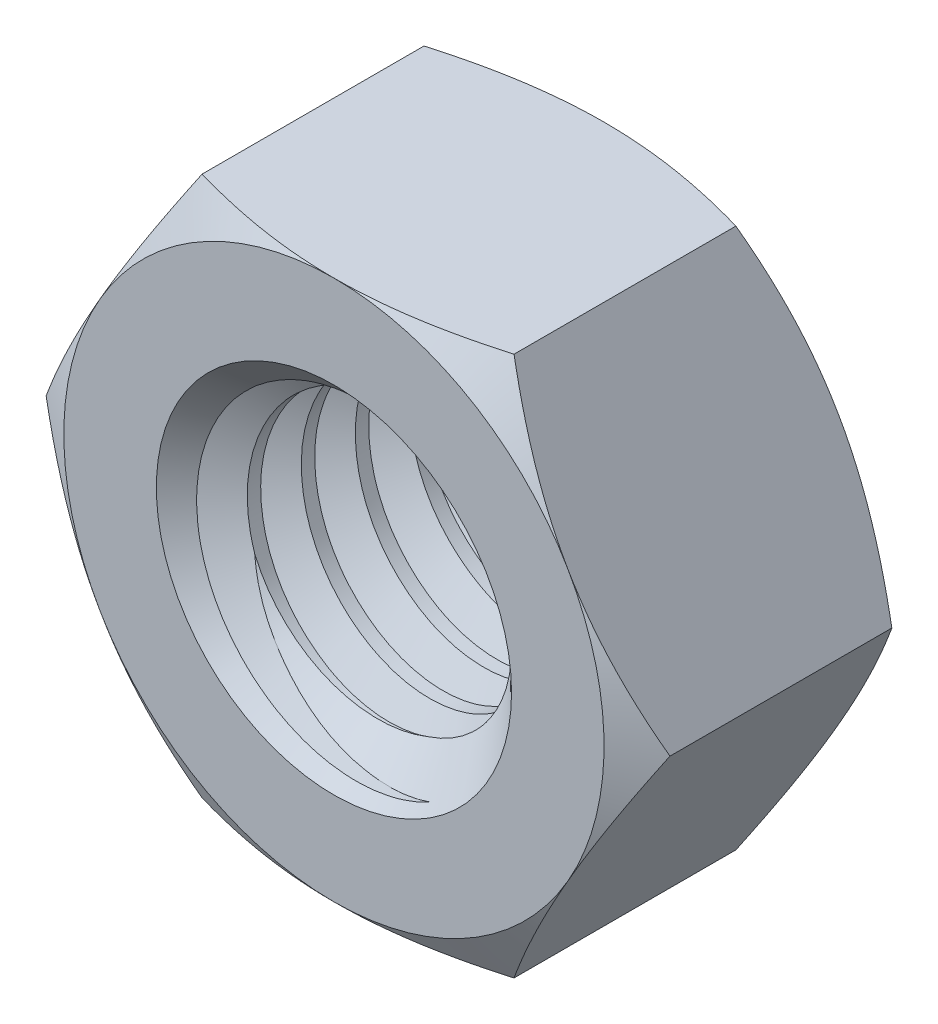
from build123d import *

# Parameters (mm, degrees)
Y_KSEKLIK_EKSTR_ZYON1_DEPTH = 4
IZIM2_OUTSIDE_W             = 27.666
IZIM2_OUTSIDE_H             = 26.428
IZIM2_OUTSIDE_R             = 4
KES_EKSTR_ZYON1_DEPTH       = 4
KES_EKSTR_ZYON1_DRAFT       = -60
IZIM3_OUTSIDE_W             = 27.666
IZIM3_OUTSIDE_H             = 26.428
IZIM3_OUTSIDE_R             = 4
KES_EKSTR_ZYON2_DEPTH       = 4
KES_EKSTR_ZYON2_DRAFT       = -60
IZIM4_R                     = 1.98
KES_EKSTR_ZYON3_DEPTH       = 4
PAH1_SIZE                   = 0.65
KES_S_P_R1_PITCH            = 0.8
KES_S_P_R1_HEIGHT           = 5
KES_S_P_R1_RADIUS           = 1.98


with BuildPart() as part:
    # Çizim1 → Yükseklik-Ekstrüzyon1 (new body)
    with BuildSketch(Plane.XY):
        Polygon((4.618802154, 0), (2.309401077, 4), (-2.309401077, 4), (-4.618802154, 0), (-2.309401077, -4), (2.309401077, -4), align=None)
    extrude(amount=Y_KSEKLIK_EKSTR_ZYON1_DEPTH)


with BuildPart() as kes_ekstr_zyon1_tool:
    # Çizim2 outside → Kes-Ekstrüzyon1 (with draft: the straight prism first)
    with BuildSketch(Plane.XY.offset(4)):
        Rectangle(IZIM2_OUTSIDE_W, IZIM2_OUTSIDE_H)
        Circle(IZIM2_OUTSIDE_R, mode=Mode.SUBTRACT)
    extrude(amount=-KES_EKSTR_ZYON1_DEPTH)
    # Kes-Ekstrüzyon1: the draft: its side faces are tilted about the plane it starts from
    kes_ekstr_zyon1_sides = [kes_ekstr_zyon1_tool.faces().sort_by_distance(p)[0] for p in [
        (0, -13.214, 2),
        (13.833, 0, 2),
        (0, 13.214, 2),
        (-13.833, 0, 2),
        (-4, 0, 2),
    ]]
    draft(kes_ekstr_zyon1_sides, Plane.XY.offset(4), KES_EKSTR_ZYON1_DRAFT)


with BuildPart() as part_1:
    add(part.part)

    # Kes-Ekstrüzyon1: cut by kes_ekstr_zyon1_tool
    add(kes_ekstr_zyon1_tool.part, mode=Mode.SUBTRACT)


with BuildPart() as kes_ekstr_zyon2_tool:
    # Çizim3 outside → Kes-Ekstrüzyon2 (with draft: the straight prism first)
    with BuildSketch(Plane(origin=(0, 0, 0), x_dir=(-1, 0, 0), z_dir=(0, 0, -1))):
        Rectangle(IZIM3_OUTSIDE_W, IZIM3_OUTSIDE_H)
        Circle(IZIM3_OUTSIDE_R, mode=Mode.SUBTRACT)
    extrude(amount=-KES_EKSTR_ZYON2_DEPTH)
    # Kes-Ekstrüzyon2: the draft: its side faces are tilted about the plane it starts from
    kes_ekstr_zyon2_sides = [kes_ekstr_zyon2_tool.faces().sort_by_distance(p)[0] for p in [
        (0, -13.214, 2),
        (-13.833, 0, 2),
        (0, 13.214, 2),
        (13.833, 0, 2),
        (4, 0, 2),
    ]]
    draft(kes_ekstr_zyon2_sides, Plane(origin=(0, 0, 0), x_dir=(-1, 0, 0), z_dir=(0, 0, -1)), KES_EKSTR_ZYON2_DRAFT)


with BuildPart() as part_2:
    add(part_1.part)

    # Kes-Ekstrüzyon2: cut by kes_ekstr_zyon2_tool
    add(kes_ekstr_zyon2_tool.part, mode=Mode.SUBTRACT)

    # Çizim4 → Kes-Ekstrüzyon3 (cut)
    with BuildSketch(Plane.XY.offset(4)):
        Circle(IZIM4_R)
    extrude(amount=-KES_EKSTR_ZYON3_DEPTH, mode=Mode.SUBTRACT)

    # Pah1
    pah1_edges = [part_2.edges().sort_by_distance(p)[0] for p in [
        (-1.98, 0, 0),
        (-1.98, 0, 4),
    ]]
    chamfer(pah1_edges, length=PAH1_SIZE)

    # Kes-Süpür1: sweep along a helix
    with BuildLine() as kes_s_p_r1_path:
        Helix(KES_S_P_R1_PITCH, KES_S_P_R1_HEIGHT, KES_S_P_R1_RADIUS, center=(0, 0, 0), direction=(0, 0, 1))
    # Çizim6 → Kes-Süpür1 (sweep, cut)
    with BuildSketch(Plane(origin=(0, 1.98, 5), x_dir=(0.06417248340128018, 5.079204879135305e-15, 0.9979388219595992), z_dir=(-0.9979388219595992, -7.898612403512853e-14, 0.06417248340128018))):
        Polygon((0, 0.52), (-0.383328785, -0.143944932), (0.383328785, -0.143944932), align=None)
    sweep(path=kes_s_p_r1_path.line, is_frenet=True, mode=Mode.SUBTRACT)


solid = part_2.part
